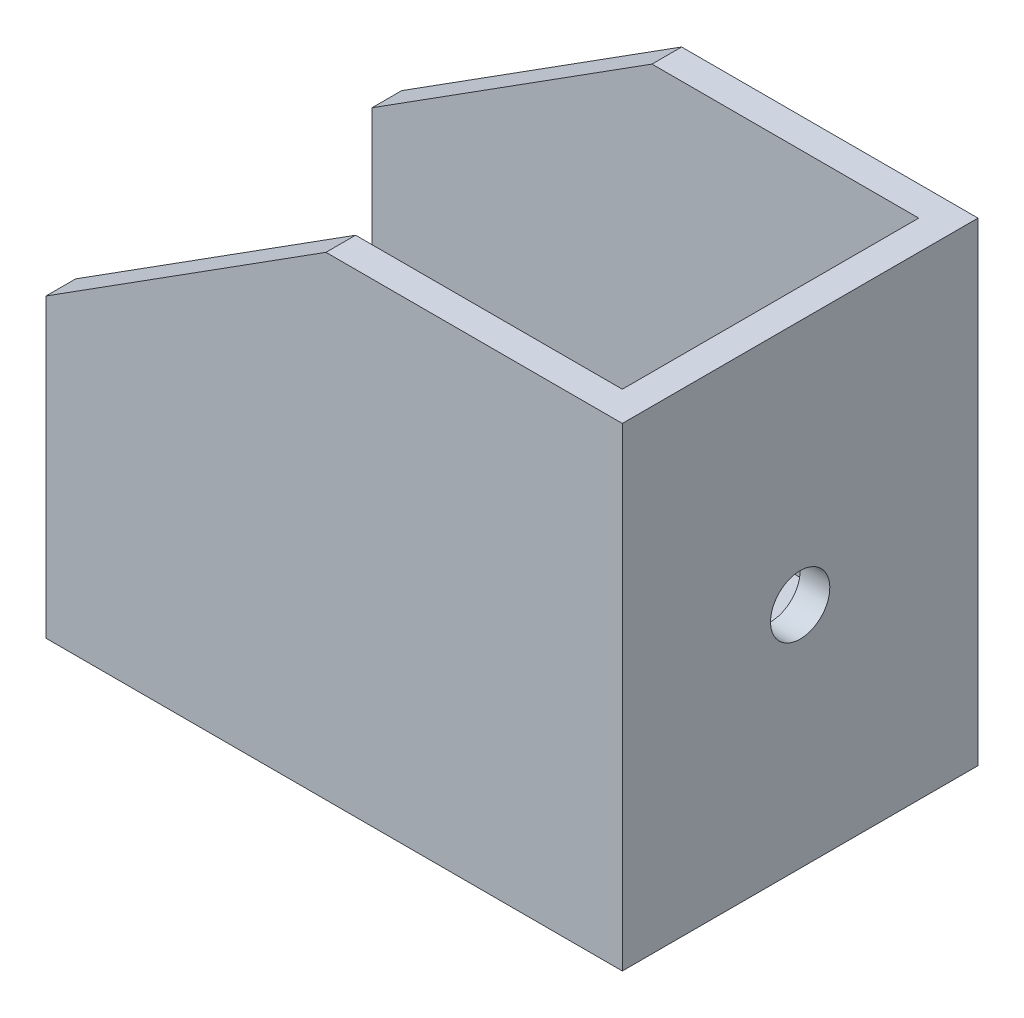
from build123d import *

# Parameters (mm, degrees)
BOSS_EXTRUDE1_DEPTH = 60
SKETCH3_W           = 50
SKETCH3_H           = 57.5
CUT_EXTRUDE6_DEPTH  = 80
SKETCH9_R           = 5
CUT_EXTRUDE7_DEPTH  = 80
SKETCH10_W          = 61.517068372
SKETCH10_H          = 50
CUT_EXTRUDE8_DEPTH  = 62.5
SKETCH13_R          = 1.5
CUT_EXTRUDE9_DEPTH  = 131.227197428


with BuildPart() as part:
    # Sketch1 → Boss-Extrude1 (new body)
    with BuildSketch(Plane.XY):
        Polygon((97.225886213, 0), (47.225886213, 0), (0, -29.989383259), (0, -80), (97.225886213, -80), align=None)
    extrude(amount=BOSS_EXTRUDE1_DEPTH)

    # Sketch3 → Cut-Extrude6 (cut)
    with BuildSketch(Plane.ZY):
        with Locations((30, -33.75)):
            Rectangle(SKETCH3_W, SKETCH3_H)
    extrude(amount=-CUT_EXTRUDE6_DEPTH, mode=Mode.SUBTRACT)

    # Sketch9 → Cut-Extrude7 (cut)
    with BuildSketch(Plane.ZY.offset(-80)):
        with Locations(Location((30, -41.5, 0), (0, 0, 270))):
            Circle(SKETCH9_R)
    extrude(amount=-CUT_EXTRUDE7_DEPTH, mode=Mode.SUBTRACT)

    # Sketch10 → Cut-Extrude8 (cut)
    with BuildSketch(Plane(origin=(0, 0, 0), x_dir=(1, 0, 0), z_dir=(0, 1, 0))):
        with Locations((61.467352027, -30)):
            Rectangle(SKETCH10_W, SKETCH10_H)
    extrude(amount=-CUT_EXTRUDE8_DEPTH, mode=Mode.SUBTRACT)

    # Sketch13 → Cut-Extrude9 (cut, through all)
    with BuildSketch(Plane(origin=(0, -62.5, 0), x_dir=(1, 0, 0), z_dir=(0, 1, 0))):
        with Locations(Location((10, -15, 0), (0, 0, 180))):
            Circle(SKETCH13_R)
        with Locations(Location((82.225886213, -15, 0), (0, 0, 180))):
            Circle(SKETCH13_R)
        with Locations(Location((10, -45, 0), (0, 0, 180))):
            Circle(SKETCH13_R)
        with Locations(Location((82.225886213, -45, 0), (0, 0, 180))):
            Circle(SKETCH13_R)
    extrude(amount=-CUT_EXTRUDE9_DEPTH, mode=Mode.SUBTRACT)


solid = part.part
